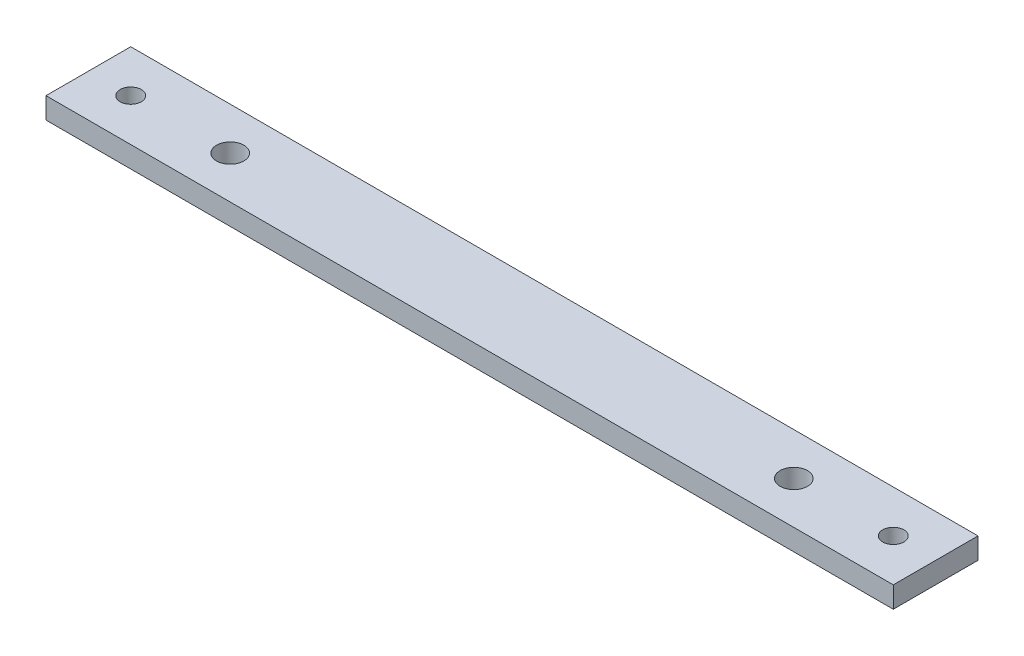
from build123d import *

# Parameters (mm, degrees)
SKETCH1_W                   = 254
SKETCH1_H                   = 25.4
BOSS_EXTRUDE1_DEPTH         = 6.35
SKETCH4_R                   = 4.1021
CUT_EXTRUDE4_DEPTH          = 256.345809639
F_1_4_0_25_DIAMETER_HOLE1_D = 6.35


with BuildPart() as part:
    # Sketch1 → Boss-Extrude1 (new body)
    with BuildSketch(Plane(origin=(0, 0, 0), x_dir=(1, 0, 0), z_dir=(0, 1, 0))):
        with Locations((-127, 12.7)):
            Rectangle(SKETCH1_W, SKETCH1_H)
    extrude(amount=BOSS_EXTRUDE1_DEPTH)

    # Sketch4 → Cut-Extrude4 (cut, through all)
    with BuildSketch(Plane.XZ):
        with Locations(Location((-211.4804, -12.7, 0), (0, 0, 270))):
            Circle(SKETCH4_R)
        with Locations(Location((-42.5196, -12.7, 0), (0, 0, 270))):
            Circle(SKETCH4_R)
    extrude(amount=-CUT_EXTRUDE4_DEPTH, mode=Mode.SUBTRACT)

    # 1/4 (0.25) Diameter Hole1 (through all)
    with Locations(Plane(origin=(0, 0, 0), x_dir=(-1, 0, 0), z_dir=(0, -1, 0))):
        with Locations((241.3, 12.7), (12.7, 12.7)):
            Hole(F_1_4_0_25_DIAMETER_HOLE1_D / 2)


solid = part.part
